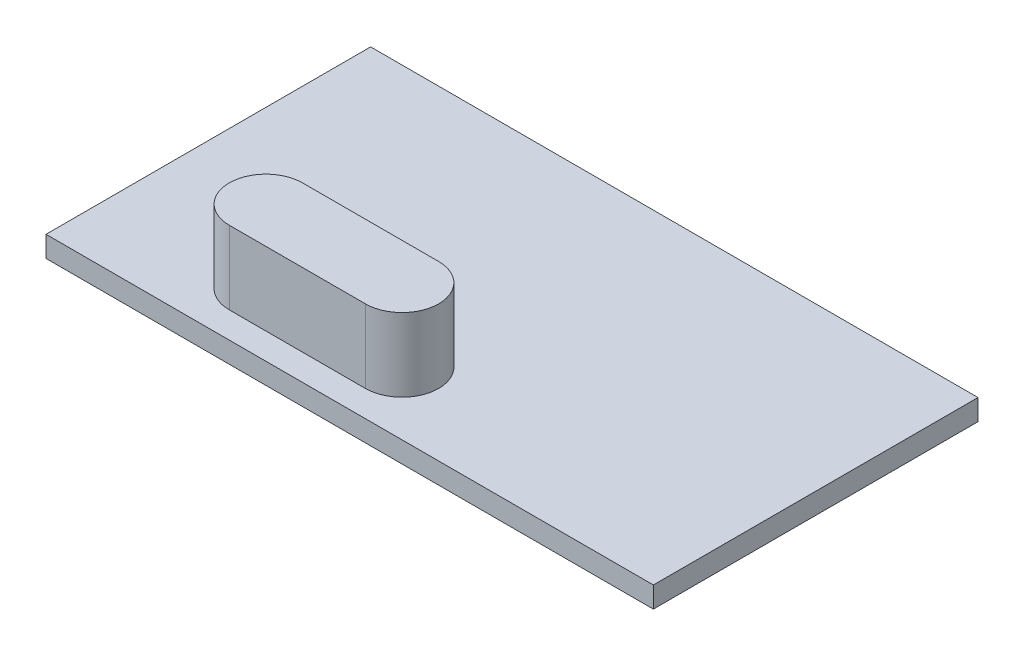
from build123d import *

# Parameters (mm, degrees)
SKETCH1_W           = 29
SKETCH1_H           = 15.5
BOSS_EXTRUDE1_DEPTH = 1
BOSS_EXTRUDE2_DEPTH = 3.5
SKETCH4_W           = 5
SKETCH4_H           = 10
BOSS_EXTRUDE3_DEPTH = 3


with BuildPart() as part:
    # Sketch1 → Boss-Extrude1 (new body)
    with BuildSketch(Plane(origin=(0, 0, 0), x_dir=(1, 0, 0), z_dir=(0, 1, 0))):
        Rectangle(SKETCH1_W, SKETCH1_H)
    extrude(amount=BOSS_EXTRUDE1_DEPTH)

    # Sketch2 → Boss-Extrude2 (add)
    with BuildSketch(Plane(origin=(0, 1, 0), x_dir=(1, 0, 0), z_dir=(0, 1, 0))):
        with BuildLine():
            Line((-7, -3), (-0.5, -3))
            ThreePointArc((-0.5, -3), (1.25, -4.75), (-0.5, -6.5))
            Line((-0.5, -6.5), (-7, -6.5))
            ThreePointArc((-7, -6.5), (-8.75, -4.75), (-7, -3))
        make_face()
    extrude(amount=BOSS_EXTRUDE2_DEPTH)

    # Sketch4 → Boss-Extrude3 (add)
    with BuildSketch(Plane.XZ):
        with Locations((-11.8, -2.25)):
            Rectangle(SKETCH4_W, SKETCH4_H)
    extrude(amount=BOSS_EXTRUDE3_DEPTH)


solid = part.part
